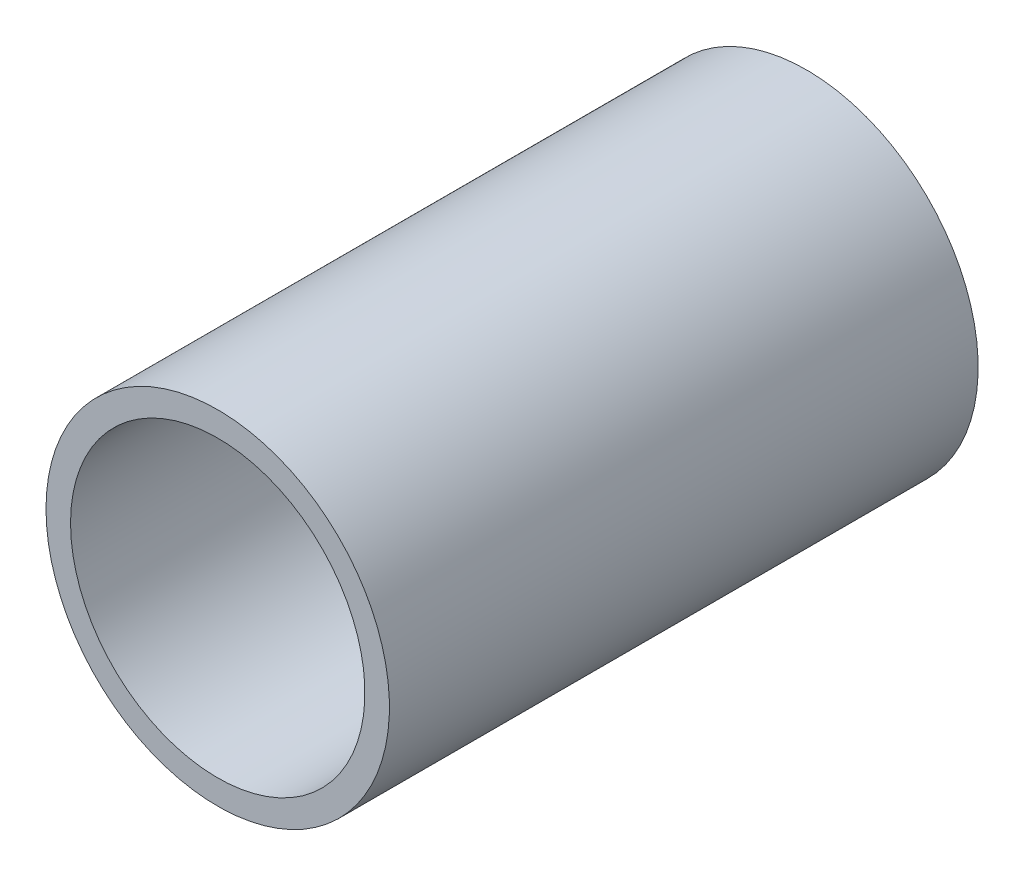
from build123d import *

# Parameters (mm, degrees)
SKETCH1_R           = 44.45
SKETCH1_R_2         = 38.1
BOSS_EXTRUDE1_DEPTH = 152.4


with BuildPart() as part:
    # Sketch1 → Boss-Extrude1 (new body)
    with BuildSketch(Plane.XY):
        with Locations(Location((-11.136337219, 23.820523204, 0), (0, 0, 180))):
            Circle(SKETCH1_R)
        with Locations(Location((-11.136337219, 23.820523204, 0), (0, 0, 180))):
            Circle(SKETCH1_R_2, mode=Mode.SUBTRACT)
    extrude(amount=BOSS_EXTRUDE1_DEPTH)


solid = part.part
